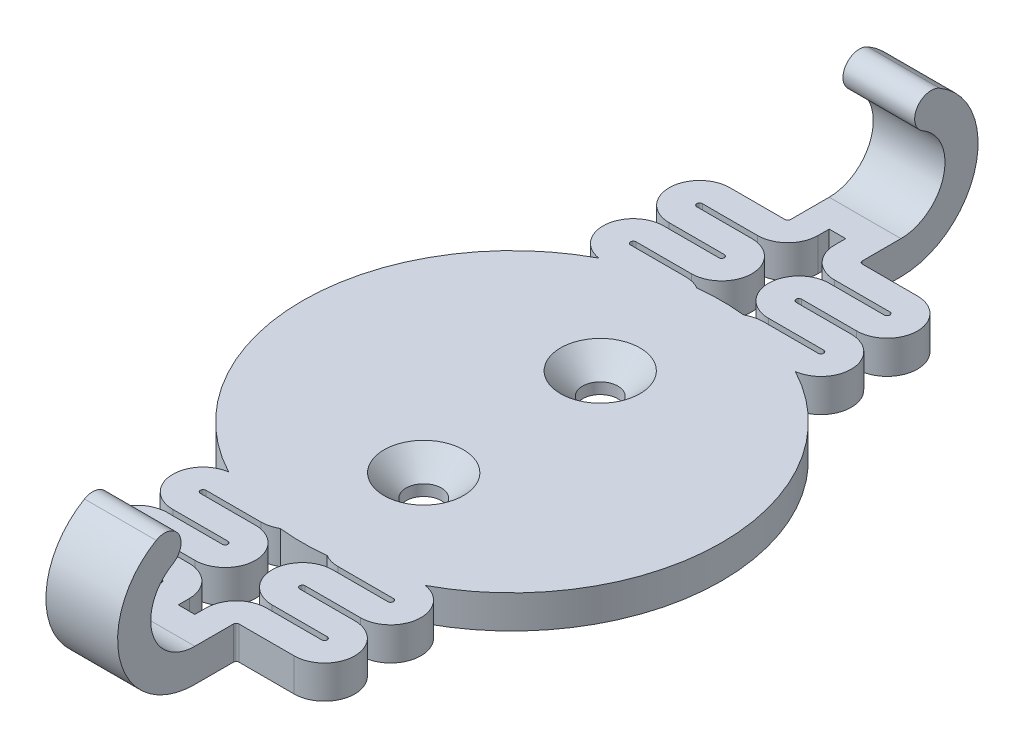
from build123d import *

# Parameters (mm, degrees)
SKETCH1_R                                  = 19
BODY_DEPTH                                 = 3
SPRING_PROFILE_DEPTH                       = 3
SPRING_PATTERN_COUNT                       = 2
SPRING_PATTERN_PITCH                       = 6
SKETCH5_W                                  = 2.5
SKETCH5_H                                  = 3
SPRING_EXTENSION_DEPTH                     = 1
MIRROR1_COPY_1_DEPTH                       = 3
MIRROR1_AT_THE_SECOND_PLANE_COPY_1_DEPTH   = 3
MIRROR1_AT_THE_SECOND_PLANE_COPY_2_DEPTH   = 3
MIRROR1_AT_THE_SECOND_PLANE_COPY_3_SKETC_W = 2.5
MIRROR1_AT_THE_SECOND_PLANE_COPY_3_SKETC_H = 3
MIRROR1_AT_THE_SECOND_PLANE_COPY_3_DEPTH   = 1
MIRROR1_AT_THE_SECOND_PLANE_COPY_4_DEPTH   = 3
CLAMP_DEPTH                                = 3.25
SKETCH6_R                                  = 1.6
SCREW_HOLES_DEPTH                          = 46.364202575
SCREW_CHAMFER_SIZE                         = 2


with BuildPart() as part:
    # Sketch1 → Body (new body)
    with BuildSketch(Plane(origin=(0, 0, 0), x_dir=(1, 0, 0), z_dir=(0, 1, 0))):
        with Locations(Location((0, 0, 0), (0, 0, 270))):
            Circle(SKETCH1_R)
    extrude(amount=BODY_DEPTH)

    # Sketch2 → Spring profile (add)
    with BuildSketch(Plane(origin=(0, 0, 0), x_dir=(1, 0, 0), z_dir=(0, 1, 0))):
        with BuildLine():
            ThreePointArc((3.25, 16.5), (3.323223305, 16.676776695), (3.5, 16.75))
            Line((3.5, 16.75), (8.5, 16.75))
            ThreePointArc((8.5, 16.75), (11.25, 19.5), (8.5, 22.25))
            Line((8.5, 22.25), (3.5, 22.25))
            ThreePointArc((3.5, 22.25), (3.323223305, 22.323223305), (3.25, 22.5))
            Line((3.25, 22.5), (0.75, 22.5))
            ThreePointArc((0.75, 22.5), (1.555456352, 20.555456352), (3.5, 19.75))
            Line((3.5, 19.75), (8.5, 19.75))
            ThreePointArc((8.5, 19.75), (8.75, 19.5), (8.5, 19.25))
            Line((8.5, 19.25), (3.5, 19.25))
            ThreePointArc((3.5, 19.25), (1.555456352, 18.444543648), (0.75, 16.5))
            Line((0.75, 16.5), (3.25, 16.5))
        make_face()
    spring_profile = extrude(amount=SPRING_PROFILE_DEPTH)

    # Spring pattern: Spring profile ×2
    with Locations(*[(0, 0, -i * SPRING_PATTERN_PITCH) for i in range(1, SPRING_PATTERN_COUNT)]):
        add(spring_profile)

    # Sketch5 → Spring extension (add)
    with BuildSketch(Plane(origin=(0, 0, -28.5), x_dir=(-1, 0, 0), z_dir=(0, 0, -1))):
        with Locations((-2, 1.5)):
            Rectangle(SKETCH5_W, SKETCH5_H)
    spring_extension = extrude(amount=SPRING_EXTENSION_DEPTH)

    # Mirror1: Spring profile, Spring extension across plane
    add(spring_profile.mirror(Plane.XY))
    add(spring_extension.mirror(Plane.XY))

    # Mirror1 copy 1 sketch → Mirror1 copy 1 (add)
    with BuildSketch(Plane(origin=(0, 0, 6), x_dir=(1, 0, 0), z_dir=(0, 1, 0))):
        with BuildLine():
            ThreePointArc((3.25, -16.5), (3.323223305, -16.676776695), (3.5, -16.75))
            Line((3.5, -16.75), (8.5, -16.75))
            ThreePointArc((8.5, -16.75), (11.25, -19.5), (8.5, -22.25))
            Line((8.5, -22.25), (3.5, -22.25))
            ThreePointArc((3.5, -22.25), (3.323223305, -22.323223305), (3.25, -22.5))
            Line((3.25, -22.5), (0.75, -22.5))
            ThreePointArc((0.75, -22.5), (1.555456352, -20.555456352), (3.5, -19.75))
            Line((3.5, -19.75), (8.5, -19.75))
            ThreePointArc((8.5, -19.75), (8.75, -19.5), (8.5, -19.25))
            Line((8.5, -19.25), (3.5, -19.25))
            ThreePointArc((3.5, -19.25), (1.555456352, -18.444543648), (0.75, -16.5))
            Line((0.75, -16.5), (3.25, -16.5))
        make_face()
    extrude(amount=MIRROR1_COPY_1_DEPTH)

    # Mirror1 at the second plane: Spring profile, Spring extension across plane
    add(spring_profile.mirror(Plane(origin=(0, 0, 0), x_dir=(0, 0, 1), z_dir=(1, 0, 0))))
    add(spring_extension.mirror(Plane(origin=(0, 0, 0), x_dir=(0, 0, 1), z_dir=(1, 0, 0))))

    # Mirror1 at the second plane copy 1 sketc → Mirror1 at the second plane copy 1 (add)
    with BuildSketch(Plane(origin=(0, 0, -6), x_dir=(-1, 0, 0), z_dir=(0, 1, 0))):
        with BuildLine():
            ThreePointArc((3.25, -16.5), (3.323223305, -16.676776695), (3.5, -16.75))
            Line((3.5, -16.75), (8.5, -16.75))
            ThreePointArc((8.5, -16.75), (11.25, -19.5), (8.5, -22.25))
            Line((8.5, -22.25), (3.5, -22.25))
            ThreePointArc((3.5, -22.25), (3.323223305, -22.323223305), (3.25, -22.5))
            Line((3.25, -22.5), (0.75, -22.5))
            ThreePointArc((0.75, -22.5), (1.555456352, -20.555456352), (3.5, -19.75))
            Line((3.5, -19.75), (8.5, -19.75))
            ThreePointArc((8.5, -19.75), (8.75, -19.5), (8.5, -19.25))
            Line((8.5, -19.25), (3.5, -19.25))
            ThreePointArc((3.5, -19.25), (1.555456352, -18.444543648), (0.75, -16.5))
            Line((0.75, -16.5), (3.25, -16.5))
        make_face()
    extrude(amount=MIRROR1_AT_THE_SECOND_PLANE_COPY_1_DEPTH)

    # Mirror1 at the second plane copy 2 sketc → Mirror1 at the second plane copy 2 (add)
    with BuildSketch(Plane(origin=(0, 0, 0), x_dir=(-1, 0, 0), z_dir=(0, 1, 0))):
        with BuildLine():
            ThreePointArc((3.25, 16.5), (3.323223305, 16.676776695), (3.5, 16.75))
            Line((3.5, 16.75), (8.5, 16.75))
            ThreePointArc((8.5, 16.75), (11.25, 19.5), (8.5, 22.25))
            Line((8.5, 22.25), (3.5, 22.25))
            ThreePointArc((3.5, 22.25), (3.323223305, 22.323223305), (3.25, 22.5))
            Line((3.25, 22.5), (0.75, 22.5))
            ThreePointArc((0.75, 22.5), (1.555456352, 20.555456352), (3.5, 19.75))
            Line((3.5, 19.75), (8.5, 19.75))
            ThreePointArc((8.5, 19.75), (8.75, 19.5), (8.5, 19.25))
            Line((8.5, 19.25), (3.5, 19.25))
            ThreePointArc((3.5, 19.25), (1.555456352, 18.444543648), (0.75, 16.5))
            Line((0.75, 16.5), (3.25, 16.5))
        make_face()
    extrude(amount=MIRROR1_AT_THE_SECOND_PLANE_COPY_2_DEPTH)



with BuildPart() as body_2:
    # Mirror1 at the second plane copy 3 sketc → Mirror1 at the second plane copy 3 (new body)
    with BuildSketch(Plane.XY.offset(28.5)):
        with Locations((-2, 1.5)):
            Rectangle(MIRROR1_AT_THE_SECOND_PLANE_COPY_3_SKETC_W, MIRROR1_AT_THE_SECOND_PLANE_COPY_3_SKETC_H)
    extrude(amount=MIRROR1_AT_THE_SECOND_PLANE_COPY_3_DEPTH)


with BuildPart() as part_1:
    add(part.part)

    add(body_2.part)  # Mirror1 at the second plane copy 4 merges body 2
    # Mirror1 at the second plane copy 4 sketc → Mirror1 at the second plane copy 4 (add)
    with BuildSketch(Plane(origin=(0, 0, 6), x_dir=(-1, 0, 0), z_dir=(0, 1, 0))):
        with BuildLine():
            ThreePointArc((3.25, 16.5), (3.323223305, 16.676776695), (3.5, 16.75))
            Line((3.5, 16.75), (8.5, 16.75))
            ThreePointArc((8.5, 16.75), (11.25, 19.5), (8.5, 22.25))
            Line((8.5, 22.25), (3.5, 22.25))
            ThreePointArc((3.5, 22.25), (3.323223305, 22.323223305), (3.25, 22.5))
            Line((3.25, 22.5), (0.75, 22.5))
            ThreePointArc((0.75, 22.5), (1.555456352, 20.555456352), (3.5, 19.75))
            Line((3.5, 19.75), (8.5, 19.75))
            ThreePointArc((8.5, 19.75), (8.75, 19.5), (8.5, 19.25))
            Line((8.5, 19.25), (3.5, 19.25))
            ThreePointArc((3.5, 19.25), (1.555456352, 18.444543648), (0.75, 16.5))
            Line((0.75, 16.5), (3.25, 16.5))
        make_face()
    extrude(amount=MIRROR1_AT_THE_SECOND_PLANE_COPY_4_DEPTH)

    # Sketch4 → Clamp (add, symmetric)
    with BuildSketch(Plane(origin=(0, 0, 0), x_dir=(0, 0, -1), z_dir=(1, 0, 0))):
        with BuildLine():
            Line((32, 0), (29.5, 0))
            Line((29.5, 0), (29.5, 3))
            Line((29.5, 3), (32, 3))
            ThreePointArc((32, 3), (35.863703305, 5.96472382), (34, 10.464101615))
            ThreePointArc((34, 10.464101615), (33.450961894, 12.513139721), (35.5, 13.062177826))
            ThreePointArc((35.5, 13.062177826), (38.761480784, 5.188266684), (32, 0))
        make_face()
    clamp = extrude(amount=CLAMP_DEPTH, both=True)

    # Mirror2: Clamp across plane
    add(clamp.mirror(Plane.XY))

    # Sketch6 → Screw holes (cut, through all)
    with BuildSketch(Plane(origin=(0, 0, 0), x_dir=(1, 0, 0), z_dir=(0, 1, 0))):
        with Locations(Location((0, -8, 0), (0, 0, 270))):
            Circle(SKETCH6_R)
        with Locations(Location((0, 8, 0), (0, 0, 270))):
            Circle(SKETCH6_R)
    extrude(amount=SCREW_HOLES_DEPTH, mode=Mode.SUBTRACT)

    # Screw chamfer
    screw_chamfer_edges = [part_1.edges().sort_by_distance(p)[0] for p in [
        (0, 3, 6.4),
        (0, 3, -9.6),
    ]]
    chamfer(screw_chamfer_edges, length=SCREW_CHAMFER_SIZE)


solid = part_1.part
